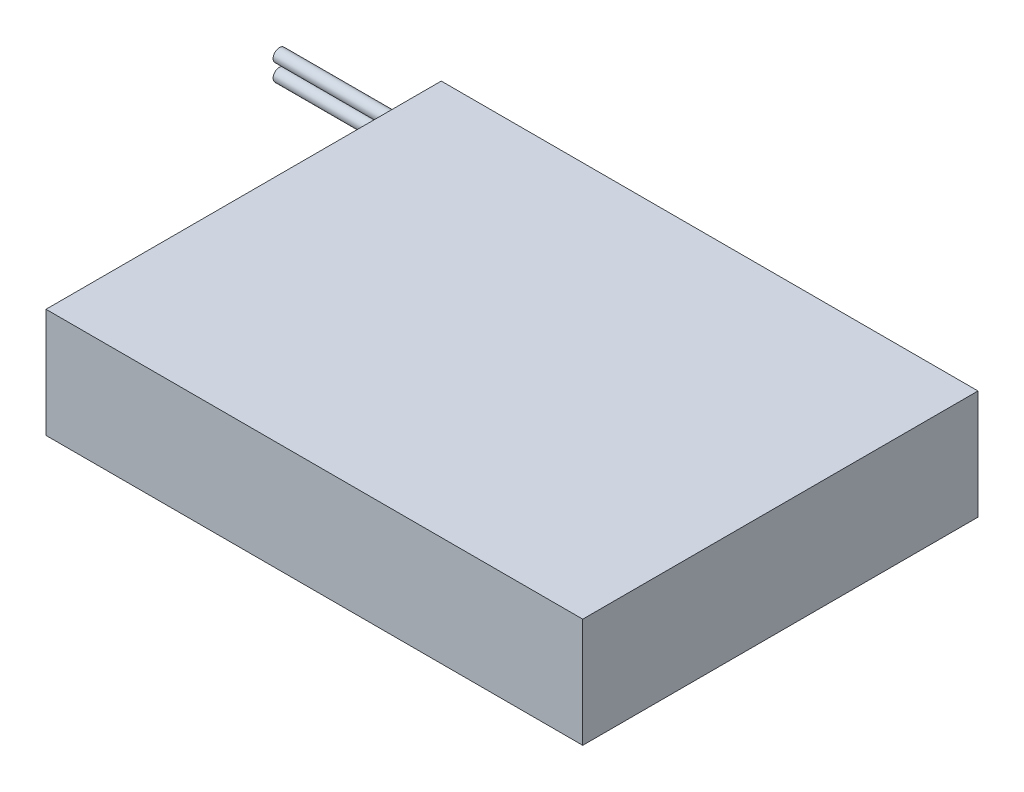
from build123d import *

# Parameters (mm, degrees)
ESQUISSE1_W        = 71.7
ESQUISSE1_H        = 52.8
BOSS_EXTRU_1_DEPTH = 7.3
ESQUISSE2_R        = 0.85
BOSS_EXTRU_2_DEPTH = 20


with BuildPart() as part:
    # Esquisse1 → Boss.-Extru.1 (new, symmetric)
    with BuildSketch(Plane(origin=(0, 0, 0), x_dir=(1, 0, 0), z_dir=(0, 1, 0))):
        Rectangle(ESQUISSE1_W, ESQUISSE1_H)
    extrude(amount=BOSS_EXTRU_1_DEPTH, both=True)

    # Esquisse2 → Boss.-Extru.2 (add)
    with BuildSketch(Plane.ZY.offset(35.85)):
        with Locations(Location((-24.787698277, 1.136553851, 0), (0, 0, 180))):
            Circle(ESQUISSE2_R)
        with Locations(Location((-24.787698277, -1.136553851, 0), (0, 0, 180))):
            Circle(ESQUISSE2_R)
    extrude(amount=BOSS_EXTRU_2_DEPTH)


solid = part.part
